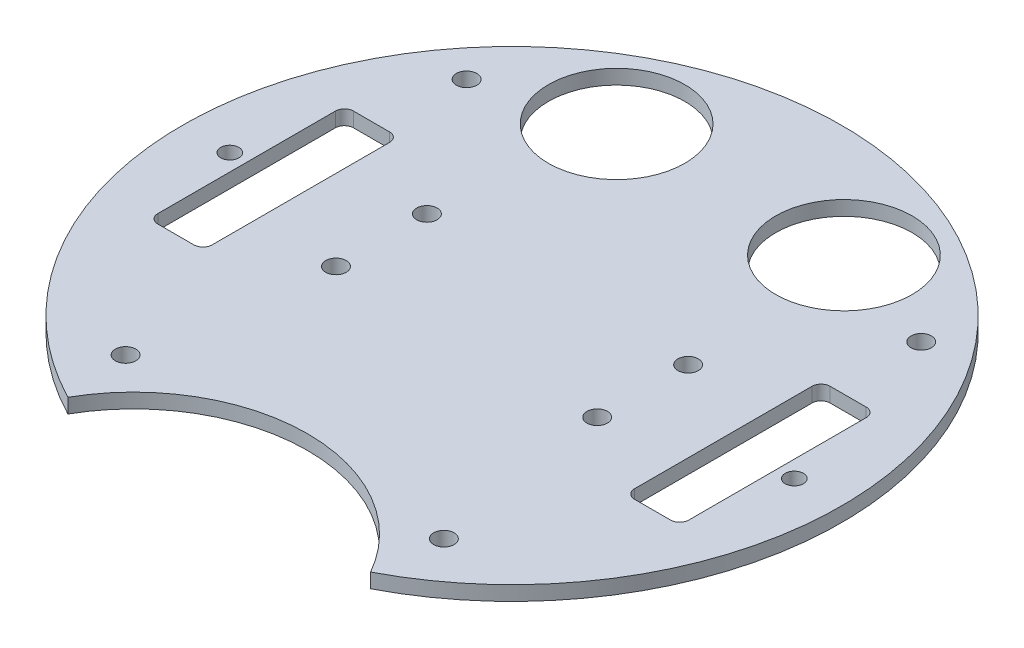
from build123d import *

# Parameters (mm, degrees)
BOSS_EXTRUDE1_DEPTH = 3.2
SKETCH2_W           = 10.76
SKETCH2_H           = 41.868700306
CUT_EXTRUDE1_DEPTH  = 103.580407486
SKETCH3_R           = 2
SKETCH3_R_2         = 2.25
CUT_EXTRUDE2_DEPTH  = 103.580407486
SKETCH4_R           = 15
CUT_EXTRUDE3_DEPTH  = 103.580407486
CUT_EXTRUDE4_DEPTH  = 103.580407486
SKETCH6_R           = 2.25
CUT_EXTRUDE5_DEPTH  = 103.580407486


with BuildPart() as part:
    # Sketch1 → Boss-Extrude1 (new body)
    with BuildSketch(Plane(origin=(0, 0, 0), x_dir=(1, 0, 0), z_dir=(0, 1, 0))):
        with BuildLine():
            ThreePointArc((33.29110537, -64.404598464), (0, 72.5), (-33.29110537, -64.404598464))
            ThreePointArc((-33.29110537, -64.404598464), (0, -44.989799638), (33.29110537, -64.404598464))
        make_face()
    extrude(amount=BOSS_EXTRUDE1_DEPTH)

    # Sketch2 → Cut-Extrude1 (cut, through all)
    with BuildSketch(Plane(origin=(0, 3.2, 0), x_dir=(1, 0, 0), z_dir=(0, 1, 0))):
        with Locations((-52.42, 0)):
            Rectangle(SKETCH2_W, SKETCH2_H)
        with Locations((52.42, 0)):
            Rectangle(SKETCH2_W, SKETCH2_H)
    extrude(amount=-CUT_EXTRUDE1_DEPTH, mode=Mode.SUBTRACT)

    # Sketch3 → Cut-Extrude2 (cut, through all)
    with BuildSketch(Plane.XZ):
        with Locations(Location((-62.08, 0, 0), (0, 0, 270))):
            Circle(SKETCH3_R)
        with Locations(Location((-28.73, 10, 0), (0, 0, 270))):
            Circle(SKETCH3_R_2)
        with Locations(Location((-28.73, -10, 0), (0, 0, 270))):
            Circle(SKETCH3_R_2)
        with Locations(Location((28.73, -10, 0), (0, 0, 90))):
            Circle(SKETCH3_R_2)
        with Locations(Location((28.73, 10, 0), (0, 0, 90))):
            Circle(SKETCH3_R_2)
        with Locations(Location((62.08, 0, 0), (0, 0, 90))):
            Circle(SKETCH3_R)
    extrude(amount=-CUT_EXTRUDE2_DEPTH, mode=Mode.SUBTRACT)

    # Sketch4 → Cut-Extrude3 (cut, through all)
    with BuildSketch(Plane(origin=(0, 3.2, 0), x_dir=(1, 0, 0), z_dir=(0, 1, 0))):
        with Locations(Location((-25, 48, 0), (0, 0, 270))):
            Circle(SKETCH4_R)
        with Locations(Location((25, 48, 0), (0, 0, 90))):
            Circle(SKETCH4_R)
    extrude(amount=-CUT_EXTRUDE3_DEPTH, mode=Mode.SUBTRACT)

    # Sketch5 → Cut-Extrude4 (cut, through all)
    with BuildSketch(Plane(origin=(0, 3.2, 0), x_dir=(1, 0, 0), z_dir=(0, 1, 0))):
        with BuildLine():
            Line((-56.385786438, 21.520136591), (-48.454213562, 21.520136591))
            ThreePointArc((-48.454213562, 21.520136591), (-47.04, 20.934350153), (-46.454213562, 19.520136591))
            Line((-46.454213562, 19.520136591), (-46.454213562, -19.520136591))
            ThreePointArc((-46.454213562, -19.520136591), (-47.04, -20.934350153), (-48.454213562, -21.520136591))
            Line((-48.454213562, -21.520136591), (-56.385786438, -21.520136591))
            ThreePointArc((-56.385786438, -21.520136591), (-57.8, -20.934350153), (-58.385786438, -19.520136591))
            Line((-58.385786438, -19.520136591), (-58.385786438, 19.520136591))
            ThreePointArc((-58.385786438, 19.520136591), (-57.8, 20.934350153), (-56.385786438, 21.520136591))
        make_face()
        with BuildLine():
            Line((46.454213562, 19.520136591), (46.454213562, -19.520136591))
            ThreePointArc((46.454213562, -19.520136591), (47.04, -20.934350153), (48.454213562, -21.520136591))
            Line((48.454213562, -21.520136591), (56.385786438, -21.520136591))
            ThreePointArc((56.385786438, -21.520136591), (57.8, -20.934350153), (58.385786438, -19.520136591))
            Line((58.385786438, -19.520136591), (58.385786438, 19.520136591))
            ThreePointArc((58.385786438, 19.520136591), (57.8, 20.934350153), (56.385786438, 21.520136591))
            Line((56.385786438, 21.520136591), (48.454213562, 21.520136591))
            ThreePointArc((48.454213562, 21.520136591), (47.04, 20.934350153), (46.454213562, 19.520136591))
        make_face()
    extrude(amount=-CUT_EXTRUDE4_DEPTH, mode=Mode.SUBTRACT)

    # Sketch6 → Cut-Extrude5 (cut, through all)
    with BuildSketch(Plane(origin=(0, 3.2, 0), x_dir=(1, 0, 0), z_dir=(0, 1, 0))):
        with Locations(Location((-50, 40, 0), (0, 0, 270))):
            Circle(SKETCH6_R)
        with Locations(Location((-35, -50, 0), (0, 0, 270))):
            Circle(SKETCH6_R)
        with Locations(Location((35, -50, 0), (0, 0, 90))):
            Circle(SKETCH6_R)
        with Locations(Location((50, 40, 0), (0, 0, 90))):
            Circle(SKETCH6_R)
    extrude(amount=-CUT_EXTRUDE5_DEPTH, mode=Mode.SUBTRACT)


solid = part.part
